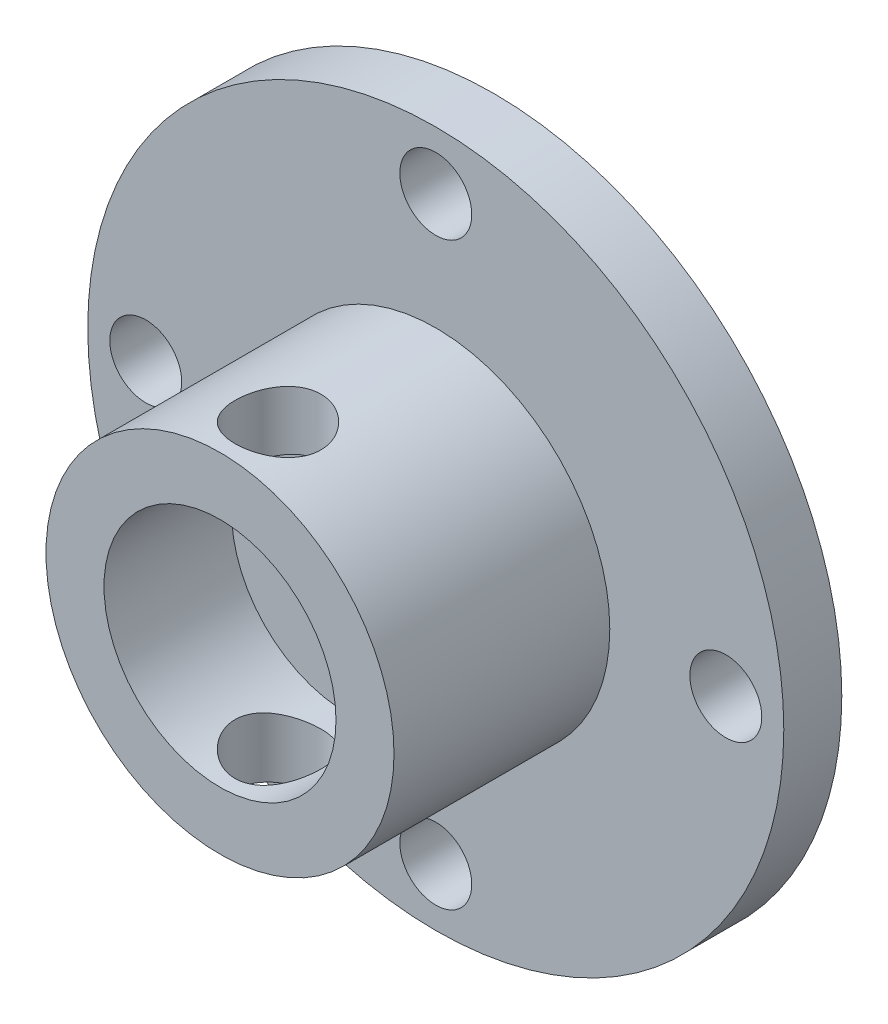
from build123d import *

# Parameters (mm, degrees)
SKETCH1_R               = 15
SKETCH1_R_2             = 1.55
BOSS_EXTRUDE1_DEPTH     = 2.5
BOSS_EXTRUDE2_START     = 2.5
SKETCH3_R               = 7.5
BOSS_EXTRUDE2_DEPTH     = 9.3
CUT_EXTRUDE1_DEPTH      = 25.274266209
CUT_EXTRUDE1_DEPTH_BACK = 25.274266209
SKETCH4_R               = 2.5
SKETCH5_R               = 5
CUT_EXTRUDE2_DEPTH      = 5.5
CUT_EXTRUDE3_DEPTH      = 25.274266209
CUT_EXTRUDE3_DEPTH_BACK = 25.274266209
SKETCH6_R               = 1.85


with BuildPart() as part:
    # Sketch1 → Boss-Extrude1 (new body)
    with BuildSketch(Plane.XY):
        Circle(SKETCH1_R)
        with Locations((0, 12.5)):
            Circle(SKETCH1_R_2, mode=Mode.SUBTRACT)
        with Locations((12.5, 0)):
            Circle(SKETCH1_R_2, mode=Mode.SUBTRACT)
        with Locations((0, -12.5)):
            Circle(SKETCH1_R_2, mode=Mode.SUBTRACT)
        with Locations((-12.5, 0)):
            Circle(SKETCH1_R_2, mode=Mode.SUBTRACT)
    extrude(amount=BOSS_EXTRUDE1_DEPTH)

    # Sketch3 → Boss-Extrude2 (add)
    with BuildSketch(Plane.XY.offset(BOSS_EXTRUDE2_START)):
        Circle(SKETCH3_R)
    extrude(amount=BOSS_EXTRUDE2_DEPTH)

    # Sketch4 → Cut-Extrude1 (cut, two sides: drawn at the far end of the back side and taken through both)
    with BuildSketch(Plane.XY.offset(11.8).offset(-CUT_EXTRUDE1_DEPTH_BACK)):
        Circle(SKETCH4_R)
    extrude(amount=CUT_EXTRUDE1_DEPTH + CUT_EXTRUDE1_DEPTH_BACK, mode=Mode.SUBTRACT)

    # Sketch5 → Cut-Extrude2 (cut)
    with BuildSketch(Plane.XY.offset(11.8)):
        Circle(SKETCH5_R)
    extrude(amount=-CUT_EXTRUDE2_DEPTH, mode=Mode.SUBTRACT)

    # Sketch6 → Cut-Extrude3 (cut, two sides: drawn at the far end of the back side and taken through both)
    with BuildSketch(Plane(origin=(0, 0, 0), x_dir=(1, 0, 0), z_dir=(0, 1, 0)).offset(-CUT_EXTRUDE3_DEPTH_BACK)):
        with Locations(Location((0, -9.3, 0), (0, 0, 270))):
            Circle(SKETCH6_R)
    extrude(amount=CUT_EXTRUDE3_DEPTH + CUT_EXTRUDE3_DEPTH_BACK, mode=Mode.SUBTRACT)


solid = part.part
